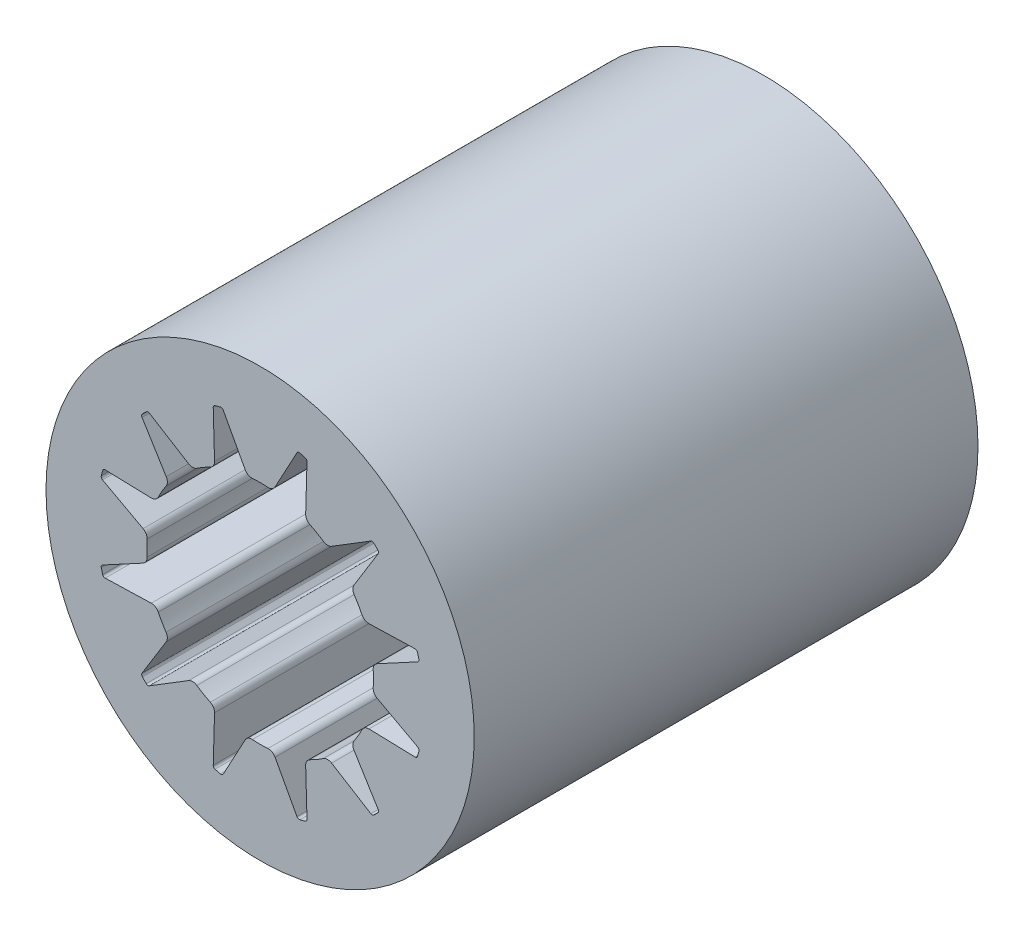
from build123d import *

# Parameters (mm, degrees)
SKETCH1_R           = 8.5
BOSS_EXTRUDE1_DEPTH = 20


with BuildPart() as part:
    # Sketch1 → Boss-Extrude1 (new body)
    with BuildSketch(Plane.XY):
        Circle(SKETCH1_R)
        with BuildLine():
            Line((-1.463336561, 6.256639256), (-0.593931236, 4.646135995))
            ThreePointArc((-0.593931236, 4.646135995), (-0.474689485, 4.525877032), (-0.309320024, 4.489356426))
            ThreePointArc((-0.309320024, 4.489356426), (0, 4.5), (0.309320024, 4.489356426))
            ThreePointArc((0.309320024, 4.489356426), (0.474689485, 4.525877032), (0.593931236, 4.646135995))
            Line((0.593931236, 4.646135995), (1.463336561, 6.256639256))
            ThreePointArc((1.463336561, 6.256639256), (1.510970427, 6.300627973), (1.575572767, 6.30615338))
            ThreePointArc((1.575572767, 6.30615338), (1.682323793, 6.278517871), (1.788590648, 6.249075411))
            ThreePointArc((1.788590648, 6.249075411), (1.841775212, 6.211989098), (1.861032992, 6.150076818))
            Line((1.861032992, 6.150076818), (1.808708459, 4.320637419))
            ThreePointArc((1.808708459, 4.320637419), (1.851845362, 4.156869226), (1.976799214, 4.042556724))
            ThreePointArc((1.976799214, 4.042556724), (2.25, 3.897114317), (2.512557212, 3.7332367))
            ThreePointArc((2.512557212, 3.7332367), (2.674031669, 3.682179741), (2.837427536, 3.726706183))
            Line((2.837427536, 3.726706183), (4.395606264, 4.686740257))
            ThreePointArc((4.395606264, 4.686740257), (4.458852761, 4.70101867), (4.517562732, 4.673502644))
            ThreePointArc((4.517562732, 4.673502644), (4.596194078, 4.596194078), (4.673502644, 4.517562732))
            ThreePointArc((4.673502644, 4.517562732), (4.70101867, 4.458852761), (4.686740257, 4.395606264))
            Line((4.686740257, 4.395606264), (3.726706183, 2.837427536))
            ThreePointArc((3.726706183, 2.837427536), (3.682179741, 2.674031669), (3.7332367, 2.512557212))
            ThreePointArc((3.7332367, 2.512557212), (3.897114317, 2.25), (4.042556724, 1.976799214))
            ThreePointArc((4.042556724, 1.976799214), (4.156869226, 1.851845362), (4.320637419, 1.808708459))
            Line((4.320637419, 1.808708459), (6.150076818, 1.861032992))
            ThreePointArc((6.150076818, 1.861032992), (6.211989098, 1.841775212), (6.249075411, 1.788590648))
            ThreePointArc((6.249075411, 1.788590648), (6.278517871, 1.682323793), (6.30615338, 1.575572767))
            ThreePointArc((6.30615338, 1.575572767), (6.300627973, 1.510970427), (6.256639256, 1.463336561))
            Line((6.256639256, 1.463336561), (4.646135995, 0.593931236))
            ThreePointArc((4.646135995, 0.593931236), (4.525877032, 0.474689485), (4.489356426, 0.309320024))
            ThreePointArc((4.489356426, 0.309320024), (4.5, 0), (4.489356426, -0.309320024))
            ThreePointArc((4.489356426, -0.309320024), (4.525877032, -0.474689485), (4.646135995, -0.593931236))
            Line((4.646135995, -0.593931236), (6.256639256, -1.463336561))
            ThreePointArc((6.256639256, -1.463336561), (6.300627973, -1.510970427), (6.30615338, -1.575572767))
            ThreePointArc((6.30615338, -1.575572767), (6.278517871, -1.682323793), (6.249075411, -1.788590648))
            ThreePointArc((6.249075411, -1.788590648), (6.211989098, -1.841775212), (6.150076818, -1.861032992))
            Line((6.150076818, -1.861032992), (4.320637419, -1.808708459))
            ThreePointArc((4.320637419, -1.808708459), (4.156869226, -1.851845362), (4.042556724, -1.976799214))
            ThreePointArc((4.042556724, -1.976799214), (3.897114317, -2.25), (3.7332367, -2.512557212))
            ThreePointArc((3.7332367, -2.512557212), (3.682179741, -2.674031669), (3.726706183, -2.837427536))
            Line((3.726706183, -2.837427536), (4.686740257, -4.395606264))
            ThreePointArc((4.686740257, -4.395606264), (4.70101867, -4.458852761), (4.673502644, -4.517562732))
            ThreePointArc((4.673502644, -4.517562732), (4.596194078, -4.596194078), (4.517562732, -4.673502644))
            ThreePointArc((4.517562732, -4.673502644), (4.458852761, -4.70101867), (4.395606264, -4.686740257))
            Line((4.395606264, -4.686740257), (2.837427536, -3.726706183))
            ThreePointArc((2.837427536, -3.726706183), (2.674031669, -3.682179741), (2.512557212, -3.7332367))
            ThreePointArc((2.512557212, -3.7332367), (2.25, -3.897114317), (1.976799214, -4.042556724))
            ThreePointArc((1.976799214, -4.042556724), (1.851845362, -4.156869226), (1.808708459, -4.320637419))
            Line((1.808708459, -4.320637419), (1.861032992, -6.150076818))
            ThreePointArc((1.861032992, -6.150076818), (1.841775212, -6.211989098), (1.788590648, -6.249075411))
            ThreePointArc((1.788590648, -6.249075411), (1.682323793, -6.278517871), (1.575572767, -6.30615338))
            ThreePointArc((1.575572767, -6.30615338), (1.510970427, -6.300627973), (1.463336561, -6.256639256))
            Line((1.463336561, -6.256639256), (0.593931236, -4.646135995))
            ThreePointArc((0.593931236, -4.646135995), (0.474689485, -4.525877032), (0.309320024, -4.489356426))
            ThreePointArc((0.309320024, -4.489356426), (0, -4.5), (-0.309320024, -4.489356426))
            ThreePointArc((-0.309320024, -4.489356426), (-0.474689485, -4.525877032), (-0.593931236, -4.646135995))
            Line((-0.593931236, -4.646135995), (-1.463336561, -6.256639256))
            ThreePointArc((-1.463336561, -6.256639256), (-1.510970427, -6.300627973), (-1.575572767, -6.30615338))
            ThreePointArc((-1.575572767, -6.30615338), (-1.682323793, -6.278517871), (-1.788590648, -6.249075411))
            ThreePointArc((-1.788590648, -6.249075411), (-1.841775212, -6.211989098), (-1.861032992, -6.150076818))
            Line((-1.861032992, -6.150076818), (-1.808708459, -4.320637419))
            ThreePointArc((-1.808708459, -4.320637419), (-1.851845362, -4.156869226), (-1.976799214, -4.042556724))
            ThreePointArc((-1.976799214, -4.042556724), (-2.25, -3.897114317), (-2.512557212, -3.7332367))
            ThreePointArc((-2.512557212, -3.7332367), (-2.674031669, -3.682179741), (-2.837427536, -3.726706183))
            Line((-2.837427536, -3.726706183), (-4.395606264, -4.686740257))
            ThreePointArc((-4.395606264, -4.686740257), (-4.458852761, -4.70101867), (-4.517562732, -4.673502644))
            ThreePointArc((-4.517562732, -4.673502644), (-4.596194078, -4.596194078), (-4.673502644, -4.517562732))
            ThreePointArc((-4.673502644, -4.517562732), (-4.70101867, -4.458852761), (-4.686740257, -4.395606264))
            Line((-4.686740257, -4.395606264), (-3.726706183, -2.837427536))
            ThreePointArc((-3.726706183, -2.837427536), (-3.682179741, -2.674031669), (-3.7332367, -2.512557212))
            ThreePointArc((-3.7332367, -2.512557212), (-3.897114317, -2.25), (-4.042556724, -1.976799214))
            ThreePointArc((-4.042556724, -1.976799214), (-4.156869226, -1.851845362), (-4.320637419, -1.808708459))
            Line((-4.320637419, -1.808708459), (-6.150076818, -1.861032992))
            ThreePointArc((-6.150076818, -1.861032992), (-6.211989098, -1.841775212), (-6.249075411, -1.788590648))
            ThreePointArc((-6.249075411, -1.788590648), (-6.278517871, -1.682323793), (-6.30615338, -1.575572767))
            ThreePointArc((-6.30615338, -1.575572767), (-6.300627973, -1.510970427), (-6.256639256, -1.463336561))
            Line((-6.256639256, -1.463336561), (-4.646135995, -0.593931236))
            ThreePointArc((-4.646135995, -0.593931236), (-4.525877032, -0.474689485), (-4.489356426, -0.309320024))
            ThreePointArc((-4.489356426, -0.309320024), (-4.5, 0), (-4.489356426, 0.309320024))
            ThreePointArc((-4.489356426, 0.309320024), (-4.525877032, 0.474689485), (-4.646135995, 0.593931236))
            Line((-4.646135995, 0.593931236), (-6.256639256, 1.463336561))
            ThreePointArc((-6.256639256, 1.463336561), (-6.300627973, 1.510970427), (-6.30615338, 1.575572767))
            ThreePointArc((-6.30615338, 1.575572767), (-6.278517871, 1.682323793), (-6.249075411, 1.788590648))
            ThreePointArc((-6.249075411, 1.788590648), (-6.211989098, 1.841775212), (-6.150076818, 1.861032992))
            Line((-6.150076818, 1.861032992), (-4.320637419, 1.808708459))
            ThreePointArc((-4.320637419, 1.808708459), (-4.156869226, 1.851845362), (-4.042556724, 1.976799214))
            ThreePointArc((-4.042556724, 1.976799214), (-3.897114317, 2.25), (-3.7332367, 2.512557212))
            ThreePointArc((-3.7332367, 2.512557212), (-3.682179741, 2.674031669), (-3.726706183, 2.837427536))
            Line((-3.726706183, 2.837427536), (-4.686740257, 4.395606264))
            ThreePointArc((-4.686740257, 4.395606264), (-4.70101867, 4.458852761), (-4.673502644, 4.517562732))
            ThreePointArc((-4.673502644, 4.517562732), (-4.596194078, 4.596194078), (-4.517562732, 4.673502644))
            ThreePointArc((-4.517562732, 4.673502644), (-4.458852761, 4.70101867), (-4.395606264, 4.686740257))
            Line((-4.395606264, 4.686740257), (-2.837427536, 3.726706183))
            ThreePointArc((-2.837427536, 3.726706183), (-2.674031669, 3.682179741), (-2.512557212, 3.7332367))
            ThreePointArc((-2.512557212, 3.7332367), (-2.25, 3.897114317), (-1.976799214, 4.042556724))
            ThreePointArc((-1.976799214, 4.042556724), (-1.851845362, 4.156869226), (-1.808708459, 4.320637419))
            Line((-1.808708459, 4.320637419), (-1.861032992, 6.150076818))
            ThreePointArc((-1.861032992, 6.150076818), (-1.841775212, 6.211989098), (-1.788590648, 6.249075411))
            ThreePointArc((-1.788590648, 6.249075411), (-1.682323793, 6.278517871), (-1.575572767, 6.30615338))
            ThreePointArc((-1.575572767, 6.30615338), (-1.510970427, 6.300627973), (-1.463336561, 6.256639256))
        make_face(mode=Mode.SUBTRACT)
    extrude(amount=BOSS_EXTRUDE1_DEPTH)


solid = part.part
